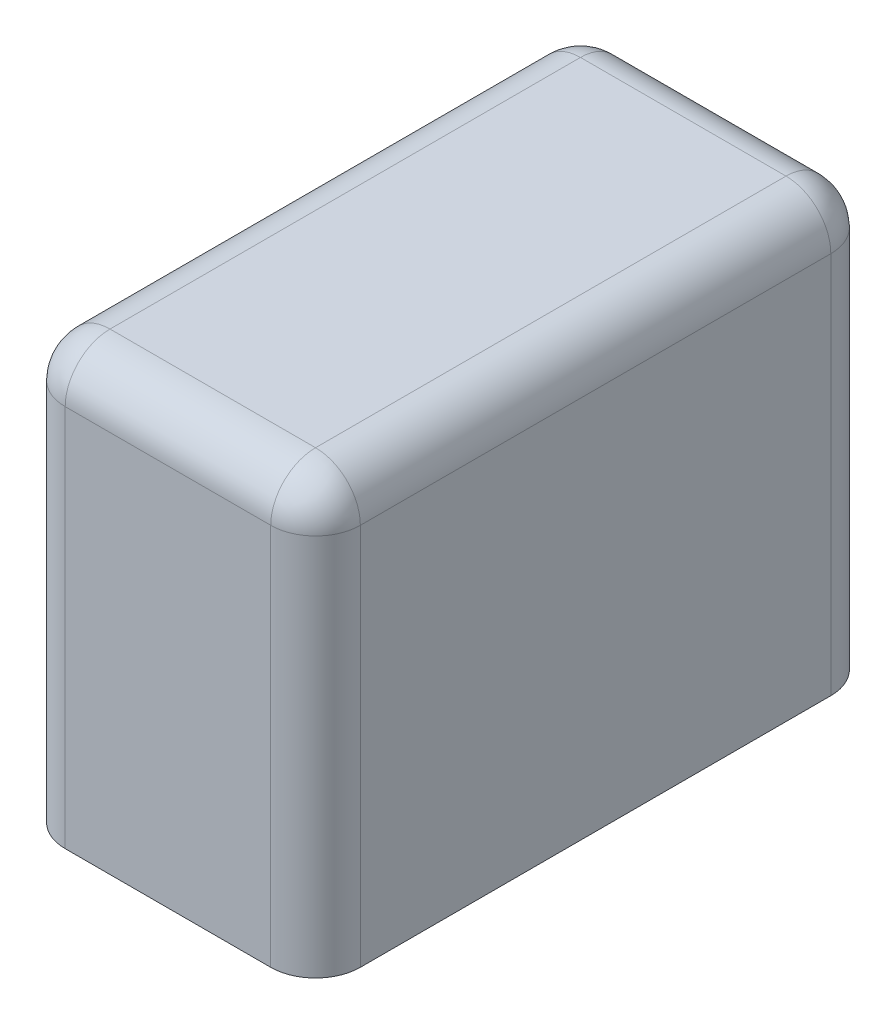
from build123d import *

# Parameters (mm, degrees)
SKETCH1_W           = 26.35
SKETCH1_H           = 50
SKETCH1_W_2         = 20
SKETCH1_H_2         = 43.65
BOSS_EXTRUDE1_DEPTH = 35
SKETCH2_W           = 26.35
SKETCH2_H           = 50
BOSS_EXTRUDE2_DEPTH = 3.175
BOSS_EXTRUDE3_DEPTH = 5
FILLET1_R           = 4
SKETCH6_W           = 10
SKETCH6_H           = 5
CUT_EXTRUDE3_DEPTH  = 3.175
SKETCH8_R           = 3.05
CUT_EXTRUDE5_DEPTH  = 2.7
BOSS_EXTRUDE4_START = -3.175
SKETCH9_W           = 6
SKETCH9_H           = 4
BOSS_EXTRUDE4_DEPTH = 12.5
SKETCH10_R          = 1
CUT_EXTRUDE6_DEPTH  = 15.675


with BuildPart() as part:
    # Sketch1 → Boss-Extrude1 (new body)
    with BuildSketch(Plane(origin=(0, 0, 0), x_dir=(1, 0, 0), z_dir=(0, 1, 0))):
        Rectangle(SKETCH1_W, SKETCH1_H)
        Rectangle(SKETCH1_W_2, SKETCH1_H_2, mode=Mode.SUBTRACT)
    extrude(amount=BOSS_EXTRUDE1_DEPTH)

    # Sketch2 → Boss-Extrude2 (add)
    with BuildSketch(Plane(origin=(0, 35, 0), x_dir=(1, 0, 0), z_dir=(0, 1, 0))):
        Rectangle(SKETCH2_W, SKETCH2_H)
    extrude(amount=BOSS_EXTRUDE2_DEPTH)

    # Sketch4 → Boss-Extrude3 (add)
    with BuildSketch(Plane.XZ):
        with BuildLine():
            Line((-8.6, -20), (-8.6, -21.825))
            Line((-8.6, -21.825), (-1.4, -21.825))
            Line((-1.4, -21.825), (-1.4, -20))
            ThreePointArc((-1.4, -20), (-5, -16.4), (-8.6, -20))
        make_face()
        with BuildLine():
            Line((-8.6, 21.825), (-1.4, 21.825))
            Line((-1.4, 21.825), (-1.4, 20))
            ThreePointArc((-1.4, 20), (-5, 16.4), (-8.6, 20))
            Line((-8.6, 20), (-8.6, 21.825))
        make_face()
    extrude(amount=-BOSS_EXTRUDE3_DEPTH)

    # Fillet1
    fillet1_edges = [part.edges().sort_by_distance(p)[0] for p in [
        (-13.175, 38.175, 0),
        (0, 38.175, 25),
        (13.175, 38.175, 0),
        (0, 38.175, -25),
        (13.175, 19.0875, 25),
        (-13.175, 19.0875, 25),
        (-13.175, 19.0875, -25),
        (13.175, 19.0875, -25),
    ]]
    fillet(fillet1_edges, radius=FILLET1_R)

    # Sketch6 → Cut-Extrude3 (cut)
    with BuildSketch(Plane.ZY.offset(13.175)):
        with Locations((0, 20.675)):
            Rectangle(SKETCH6_W, SKETCH6_H)
    extrude(amount=-CUT_EXTRUDE3_DEPTH, mode=Mode.SUBTRACT)

    # Sketch8 → Cut-Extrude5 (cut)
    with BuildSketch(Plane.XZ):
        with Locations(Location((-5, -20, 0), (0, 0, 270))):
            Circle(SKETCH8_R)
        with Locations(Location((-5, 20, 0), (0, 0, 270))):
            Circle(SKETCH8_R)
    extrude(amount=-CUT_EXTRUDE5_DEPTH, mode=Mode.SUBTRACT)

    # Sketch9 → Boss-Extrude4 (add)
    with BuildSketch(Plane(origin=(13.175, 0, 0), x_dir=(0, 0, -1), z_dir=(1, 0, 0)).offset(BOSS_EXTRUDE4_START)):
        with Locations((19.5, 9.6)):
            Rectangle(SKETCH9_W, SKETCH9_H)
        with Locations((-9.25, 9.6)):
            Rectangle(SKETCH9_W, SKETCH9_H)
    extrude(amount=-BOSS_EXTRUDE4_DEPTH)

    # Sketch10 → Cut-Extrude6 (cut)
    with BuildSketch(Plane.XZ.offset(-7.6)):
        with Locations(Location((3.75, 8.575, 0), (0, 0, 270))):
            Circle(SKETCH10_R)
        with Locations(Location((3.75, -18.825, 0), (0, 0, 270))):
            Circle(SKETCH10_R)
    extrude(amount=-CUT_EXTRUDE6_DEPTH, mode=Mode.SUBTRACT)


solid = part.part
